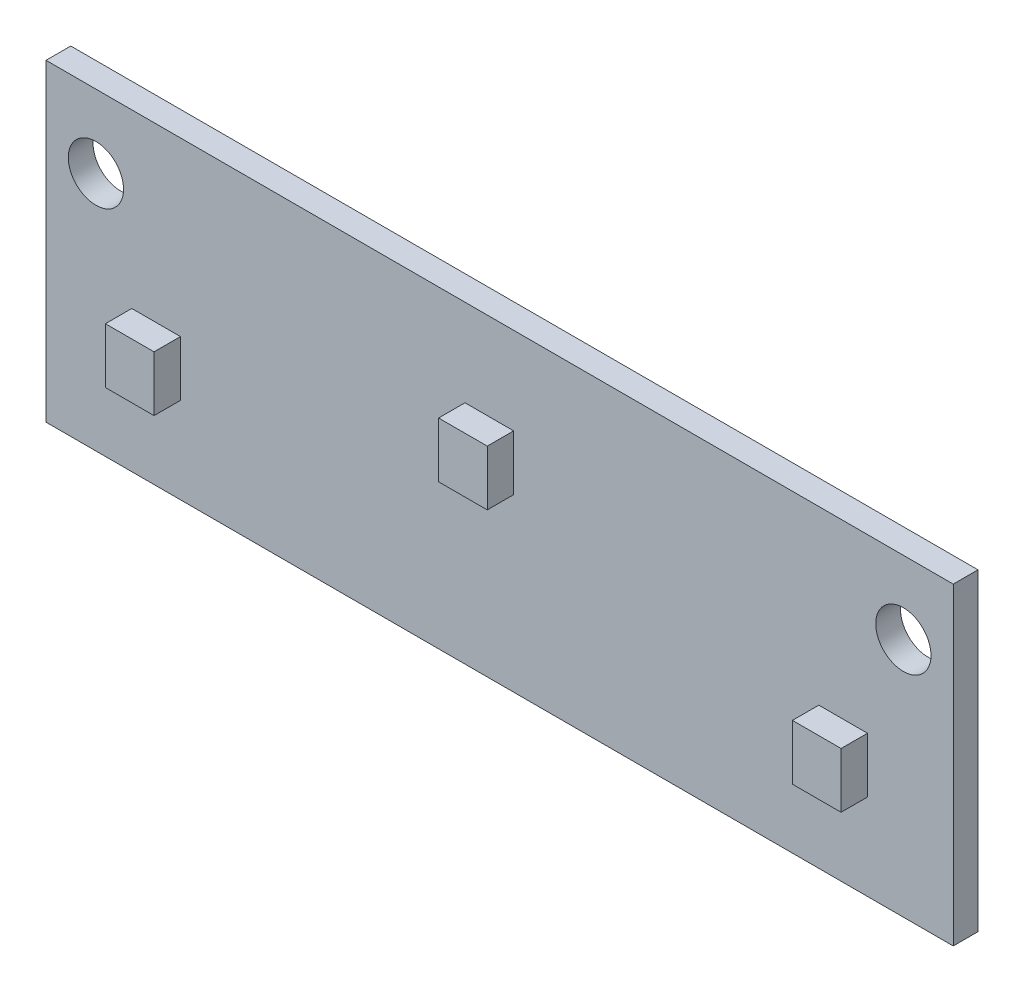
from build123d import *

# Parameters (mm, degrees)
SKETCH1_W           = 55
SKETCH1_H           = 19
BOSS_EXTRUDE1_DEPTH = 1.5
SKETCH2_R           = 1.675
CUT_EXTRUDE1_DEPTH  = 1.5
SKETCH3_W           = 2.95
SKETCH3_H           = 3.35
BOSS_EXTRUDE2_DEPTH = 1.6


with BuildPart() as part:
    # Sketch1 → Boss-Extrude1 (new body)
    with BuildSketch(Plane.XY):
        Rectangle(SKETCH1_W, SKETCH1_H)
    extrude(amount=BOSS_EXTRUDE1_DEPTH)

    # Sketch2 → Cut-Extrude1 (cut)
    with BuildSketch(Plane.XY.offset(1.5)):
        with Locations((-24.475, 5.075)):
            Circle(SKETCH2_R)
        with Locations((24.475, 5.075)):
            Circle(SKETCH2_R)
    extrude(amount=-CUT_EXTRUDE1_DEPTH, mode=Mode.SUBTRACT)

    # Sketch3 → Boss-Extrude2 (add)
    with BuildSketch(Plane.XY.offset(1.5)):
        with Locations((-0.625, 2.545)):
            Rectangle(SKETCH3_W, SKETCH3_H)
        with Locations((20.825, -2.605)):
            Rectangle(SKETCH3_W, SKETCH3_H)
        with Locations((-20.825, -2.605)):
            Rectangle(SKETCH3_W, SKETCH3_H)
    extrude(amount=BOSS_EXTRUDE2_DEPTH)


solid = part.part
